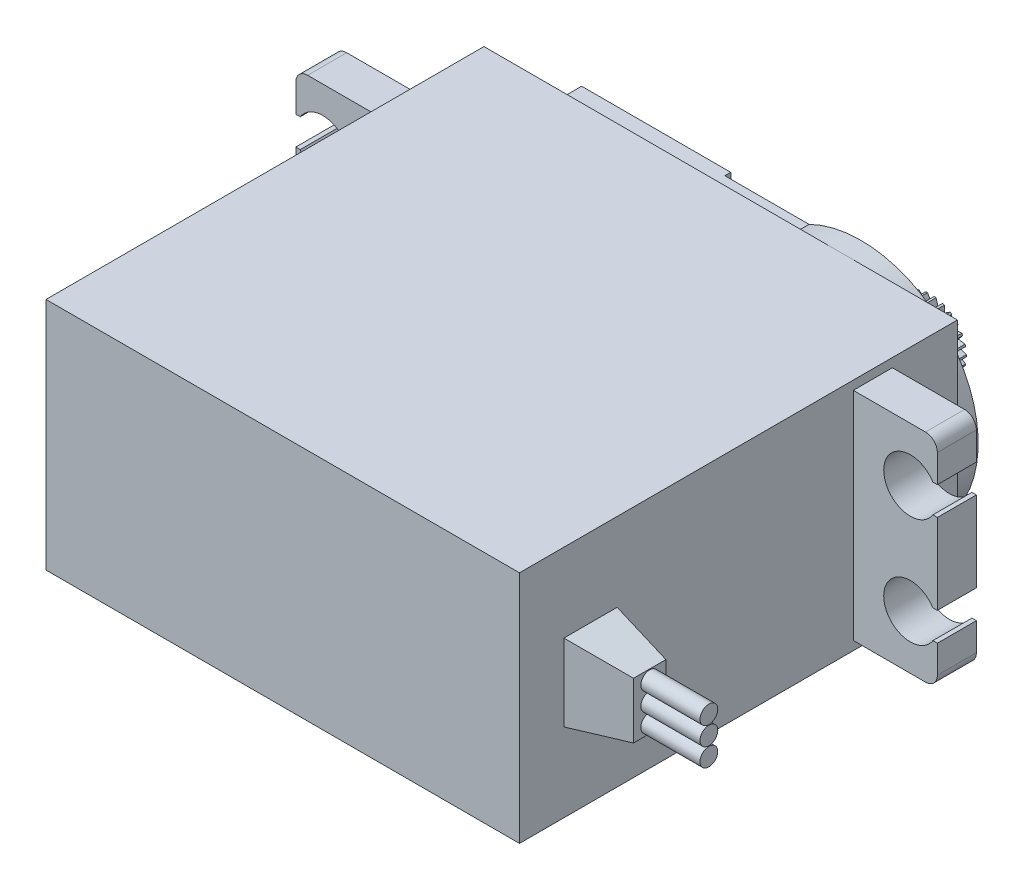
from build123d import *

# Parameters (mm, degrees)
SKETCH1_W               = 40
SKETCH1_H               = 37
BOSS_EXTRUDE1_DEPTH     = 9.9
BOSS_EXTRUDE2_DEPTH     = 1.75
SKETCH3_R               = 6.55
BOSS_EXTRUDE3_DEPTH     = 1.25
SKETCH4_R               = 5.375
BOSS_EXTRUDE4_DEPTH     = 0.65
SKETCH5_W               = 3.3
SKETCH5_H               = 18.3
BOSS_EXTRUDE5_DEPTH     = 7.1
SKETCH6_R               = 2.25
CUT_EXTRUDE1_DEPTH      = 3.3
FILLET1_R               = 1
MIRROR4_COPY_1_SKETCH_R = 2.25
MIRROR4_COPY_1_DEPTH    = 3.3
FILLET1_OF_MIRROR4_R    = 1
BOSS_EXTRUDE6_DEPTH     = 0.5
SKETCH9_W               = 4.5
SKETCH9_H               = 6.5
BOSS_EXTRUDE7_DEPTH     = 5
BOSS_EXTRUDE7_TAPER     = 10
SKETCH10_R              = 0.75
BOSS_EXTRUDE9_DEPTH     = 5
SKETCH11_R              = 3
BOSS_EXTRUDE10_DEPTH    = 4
CUT_EXTRUDE3_START      = -4
CUT_EXTRUDE3_DEPTH      = 4
SKETCH13_R              = 1.3
CUT_EXTRUDE4_DEPTH      = 4
BOSS_EXTRUDE11_DEPTH    = 0.5


with BuildPart() as part:
    # Sketch1 → Boss-Extrude1 (new, symmetric)
    with BuildSketch(Plane(origin=(0, 0, 0), x_dir=(1, 0, 0), z_dir=(0, 1, 0))):
        Rectangle(SKETCH1_W, SKETCH1_H)
    extrude(amount=BOSS_EXTRUDE1_DEPTH, both=True)

    # Sketch2 → Boss-Extrude2 (add)
    with BuildSketch(Plane(origin=(0, 0, -18.5), x_dir=(-1, 0, 0), z_dir=(0, 0, -1))):
        with BuildLine():
            Line((14, 8.875), (-5.713158881, 8.875))
            ThreePointArc((-5.713158881, 8.875), (-20, 0), (-5.713158881, -8.875))
            Line((-5.713158881, -8.875), (14, -8.875))
            Line((14, -8.875), (14, -4.625))
            ThreePointArc((14, -4.625), (16.25, 0), (14, 4.625))
            Line((14, 4.625), (14, 8.875))
        make_face()
    extrude(amount=BOSS_EXTRUDE2_DEPTH)

    # Sketch3 → Boss-Extrude3 (add)
    with BuildSketch(Plane(origin=(0, 0, -20.25), x_dir=(-1, 0, 0), z_dir=(0, 0, -1))):
        with Locations((-10.1, 0)):
            Circle(SKETCH3_R)
    extrude(amount=BOSS_EXTRUDE3_DEPTH)

    # Sketch4 → Boss-Extrude4 (add)
    with BuildSketch(Plane(origin=(0, 0, -21.5), x_dir=(-1, 0, 0), z_dir=(0, 0, -1))):
        with Locations((-10.1, 0)):
            Circle(SKETCH4_R)
    extrude(amount=BOSS_EXTRUDE4_DEPTH)

    # Sketch5 → Boss-Extrude5 (add)
    with BuildSketch(Plane.ZY.offset(20)):
        with Locations((-11.35, 0)):
            Rectangle(SKETCH5_W, SKETCH5_H)
    boss_extrude5 = extrude(amount=BOSS_EXTRUDE5_DEPTH)

    # Sketch6 → Cut-Extrude1 (cut)
    with BuildSketch(Plane(origin=(0, 0, -13), x_dir=(-1, 0, 0), z_dir=(0, 0, -1))):
        with BuildLine():
            Line((26.723286631, 3.4), (27.1, 3.4))
            Line((27.1, 3.4), (27.1, 5.8))
            Line((27.1, 5.8), (26.723286631, 5.8))
            ThreePointArc((26.723286631, 5.8), (26.981584479, 5.224541864), (27.07, 4.6))
            ThreePointArc((27.07, 4.6), (26.981584479, 3.975458136), (26.723286631, 3.4))
        make_face()
        with Locations((24.82, 4.6)):
            Circle(SKETCH6_R)
    cut_extrude1 = extrude(amount=-CUT_EXTRUDE1_DEPTH, mode=Mode.SUBTRACT)

    # Mirror1: Cut-Extrude1 across plane
    add(cut_extrude1.mirror(Plane.ZX), mode=Mode.SUBTRACT)

    # Fillet1
    fillet1_edges = [part.edges().sort_by_distance(p)[0] for p in [
        (-27.1, 9.15, -11.35),
        (-27.1, -9.15, -11.35),
    ]]
    fillet(fillet1_edges, radius=FILLET1_R)

    # Mirror4: Boss-Extrude5, Cut-Extrude1 across plane
    add(boss_extrude5.mirror(Plane(origin=(0, 0, 0), x_dir=(0, 0, 1), z_dir=(1, 0, 0))))
    add(cut_extrude1.mirror(Plane(origin=(0, 0, 0), x_dir=(0, 0, 1), z_dir=(1, 0, 0))), mode=Mode.SUBTRACT)

    # Mirror4 copy 1 sketch → Mirror4 copy 1 (cut)
    with BuildSketch(Plane(origin=(0, 0, -13), x_dir=(1, 0, 0), z_dir=(0, 0, -1))):
        with BuildLine():
            Line((26.723286631, 3.4), (27.1, 3.4))
            Line((27.1, 3.4), (27.1, 5.8))
            Line((27.1, 5.8), (26.723286631, 5.8))
            ThreePointArc((26.723286631, 5.8), (26.981584479, 5.224541864), (27.07, 4.6))
            ThreePointArc((27.07, 4.6), (26.981584479, 3.975458136), (26.723286631, 3.4))
        make_face()
        with Locations((24.82, 4.6)):
            Circle(MIRROR4_COPY_1_SKETCH_R)
    extrude(amount=-MIRROR4_COPY_1_DEPTH, mode=Mode.SUBTRACT)

    # Fillet1 of Mirror4
    fillet1_of_mirror4_edges = [part.edges().sort_by_distance(p)[0] for p in [
        (27.1, 9.15, -11.35),
        (27.1, -9.15, -11.35),
    ]]
    fillet(fillet1_of_mirror4_edges, radius=FILLET1_OF_MIRROR4_R)

    # Sketch8 → Boss-Extrude6 (add)
    with BuildSketch(Plane(origin=(0, 0, -20.25), x_dir=(-1, 0, 0), z_dir=(0, 0, -1))):
        with BuildLine():
            Line((1.4, -1.875), (1.4, 1.875))
            ThreePointArc((1.4, 1.875), (-0.475, 0), (1.4, -1.875))
        make_face()
        Polygon((14, 4.625), (14, 8.875), (1.4, 8.875), (1.4, 1.875), (1.4, -1.875), (1.4, -8.875), (14, -8.875), (14, -4.625), align=None)
    extrude(amount=BOSS_EXTRUDE6_DEPTH)

    # Sketch9 → Boss-Extrude7 (add)
    with BuildSketch(Plane(origin=(20, 0, 0), x_dir=(0, 0, -1), z_dir=(1, 0, 0))):
        with Locations((-12.5, 0)):
            Rectangle(SKETCH9_W, SKETCH9_H)
    extrude(amount=BOSS_EXTRUDE7_DEPTH, taper=BOSS_EXTRUDE7_TAPER)

    # Sketch10 → Boss-Extrude9 (add)
    with BuildSketch(Plane(origin=(25, 0, 0), x_dir=(0, 0, -1), z_dir=(1, 0, 0))):
        with Locations(Location((-12.5, 0, 0), (0, 0, 180))):
            Circle(SKETCH10_R)
        with Locations(Location((-12.5, 1.55, 0), (0, 0, 180))):
            Circle(SKETCH10_R)
        with Locations(Location((-12.5, -1.55, 0), (0, 0, 180))):
            Circle(SKETCH10_R)
    extrude(amount=BOSS_EXTRUDE9_DEPTH)

    # Sketch11 → Boss-Extrude10 (add)
    with BuildSketch(Plane(origin=(0, 0, -22.15), x_dir=(-1, 0, 0), z_dir=(0, 0, -1))):
        with Locations((-10.1, 0)):
            Circle(SKETCH11_R)
    extrude(amount=BOSS_EXTRUDE10_DEPTH)

    # Sketch12 → Cut-Extrude3 (cut)
    with BuildSketch(Plane(origin=(0, 0, -26.15), x_dir=(-1, 0, 0), z_dir=(0, 0, -1)).offset(CUT_EXTRUDE3_START)):
        with BuildLine():
            ThreePointArc((-9.81894274, 2.986805453), (-9.959316597, 2.996699548), (-10.1, 3))
            Line((-10.1, 3), (-10.1, 2.5))
            Line((-10.1, 2.5), (-9.81894274, 2.986805453))
        make_face()
        with BuildLine():
            Line((-10.1, 2.5), (-10.1, 3))
            ThreePointArc((-10.1, 3), (-10.240683403, 2.996699548), (-10.38105726, 2.986805453))
            Line((-10.38105726, 2.986805453), (-10.1, 2.5))
        make_face()
        with BuildLine():
            Line((-10.698289161, 2.427354544), (-10.541899085, 2.96727572))
            ThreePointArc((-10.541899085, 2.96727572), (-10.680561744, 2.943288647), (-10.817946993, 2.912825452))
            Line((-10.817946993, 2.912825452), (-10.698289161, 2.427354544))
        make_face()
        with BuildLine():
            Line((-11.087679578, 2.83275291), (-10.698289161, 2.427354544))
            Line((-10.698289161, 2.427354544), (-10.817946993, 2.912825452))
            ThreePointArc((-10.817946993, 2.912825452), (-10.953752542, 2.875953163), (-11.087679578, 2.83275291))
        make_face()
        with BuildLine():
            Line((-11.26180793, 2.213640064), (-11.239173861, 2.775298707))
            ThreePointArc((-11.239173861, 2.775298707), (-11.368066753, 2.718824509), (-11.494169516, 2.656368077))
            Line((-11.494169516, 2.656368077), (-11.26180793, 2.213640064))
        make_face()
        with BuildLine():
            Line((-11.736901549, 2.514071065), (-11.26180793, 2.213640064))
            Line((-11.26180793, 2.213640064), (-11.494169516, 2.656368077))
            ThreePointArc((-11.494169516, 2.656368077), (-11.617204686, 2.588066835), (-11.736901549, 2.514071065))
        make_face()
        with BuildLine():
            Line((-7.294951272, 1.063814661), (-7.762459393, 0.886512218))
            Line((-7.762459393, 0.886512218), (-7.207624109, 0.796342708))
            ThreePointArc((-7.207624109, 0.796342708), (-7.248150226, 0.931103038), (-7.294951272, 1.063814661))
        make_face()
        with BuildLine():
            ThreePointArc((-7.294951272, 1.063814661), (-7.34792427, 1.194185571), (-7.406952665, 1.321928913))
            Line((-7.406952665, 1.321928913), (-7.762459393, 0.886512218))
            Line((-7.762459393, 0.886512218), (-7.294951272, 1.063814661))
        make_face()
        with BuildLine():
            Line((-11.757806646, 1.87127687), (-11.870243992, 2.422031422))
            ThreePointArc((-11.870243992, 2.422031422), (-12.089367975, 2.245532245), (-12.290992752, 2.049280548))
            Line((-12.290992752, 2.049280548), (-11.757806646, 1.87127687))
        make_face()
        with BuildLine():
            Line((-12.157459665, 1.420161867), (-12.398433978, 1.928004473))
            ThreePointArc((-12.398433978, 1.928004473), (-12.568951598, 1.70419424), (-12.71775142, 1.465393293))
            Line((-12.71775142, 1.465393293), (-12.157459665, 1.420161867))
        make_face()
        with BuildLine():
            Line((-12.437540607, 0.886512218), (-12.793047335, 1.321928913))
            ThreePointArc((-12.793047335, 1.321928913), (-12.905048728, 1.063814661), (-12.992375891, 0.796342708))
            Line((-12.992375891, 0.796342708), (-12.437540607, 0.886512218))
        make_face()
        with BuildLine():
            Line((-9.501710839, 2.427354544), (-9.112320422, 2.83275291))
            ThreePointArc((-9.112320422, 2.83275291), (-9.382053007, 2.912825452), (-9.658100915, 2.96727572))
            Line((-9.658100915, 2.96727572), (-9.501710839, 2.427354544))
        make_face()
        with BuildLine():
            Line((-8.93819207, 2.213640064), (-8.463098451, 2.514071065))
            ThreePointArc((-8.463098451, 2.514071065), (-8.705830484, 2.656368077), (-8.960826139, 2.775298707))
            Line((-8.960826139, 2.775298707), (-8.93819207, 2.213640064))
        make_face()
        with BuildLine():
            Line((-8.442193354, 1.87127687), (-7.909007248, 2.049280548))
            ThreePointArc((-7.909007248, 2.049280548), (-8.110632025, 2.245532245), (-8.329756008, 2.422031422))
            Line((-8.329756008, 2.422031422), (-8.442193354, 1.87127687))
        make_face()
        with BuildLine():
            Line((-8.042540335, 1.420161867), (-7.48224858, 1.465393293))
            ThreePointArc((-7.48224858, 1.465393293), (-7.631048402, 1.70419424), (-7.801566022, 1.928004473))
            Line((-7.801566022, 1.928004473), (-8.042540335, 1.420161867))
        make_face()
        with BuildLine():
            Line((-7.618227815, 0.301341701), (-7.101094012, 0.081011578))
            ThreePointArc((-7.101094012, 0.081011578), (-7.121873378, 0.361610041), (-7.16884943, 0.63902765))
            Line((-7.16884943, 0.63902765), (-7.618227815, 0.301341701))
        make_face()
        with BuildLine():
            Line((-7.618227815, -0.301341701), (-7.16884943, -0.63902765))
            ThreePointArc((-7.16884943, -0.63902765), (-7.121873378, -0.361610041), (-7.101094012, -0.081011578))
            Line((-7.101094012, -0.081011578), (-7.618227815, -0.301341701))
        make_face()
        with BuildLine():
            Line((-7.762459393, -0.886512218), (-7.406952665, -1.321928913))
            ThreePointArc((-7.406952665, -1.321928913), (-7.294951272, -1.063814661), (-7.207624109, -0.796342708))
            Line((-7.207624109, -0.796342708), (-7.762459393, -0.886512218))
        make_face()
        with BuildLine():
            Line((-8.042540335, -1.420161867), (-7.801566022, -1.928004473))
            ThreePointArc((-7.801566022, -1.928004473), (-7.631048402, -1.70419424), (-7.48224858, -1.465393293))
            Line((-7.48224858, -1.465393293), (-8.042540335, -1.420161867))
        make_face()
        with BuildLine():
            Line((-8.442193354, -1.87127687), (-7.909007248, -2.049280548))
            ThreePointArc((-7.909007248, -2.049280548), (-8.110632025, -2.245532245), (-8.329756008, -2.422031422))
            Line((-8.329756008, -2.422031422), (-8.442193354, -1.87127687))
        make_face()
        with BuildLine():
            Line((-8.93819207, -2.213640064), (-8.960826139, -2.775298707))
            ThreePointArc((-8.960826139, -2.775298707), (-8.705830484, -2.656368077), (-8.463098451, -2.514071065))
            Line((-8.463098451, -2.514071065), (-8.93819207, -2.213640064))
        make_face()
        with BuildLine():
            Line((-9.501710839, -2.427354544), (-9.112320422, -2.83275291))
            ThreePointArc((-9.112320422, -2.83275291), (-9.382053007, -2.912825452), (-9.658100915, -2.96727572))
            Line((-9.658100915, -2.96727572), (-9.501710839, -2.427354544))
        make_face()
        with BuildLine():
            Line((-10.1, -2.5), (-9.81894274, -2.986805453))
            ThreePointArc((-9.81894274, -2.986805453), (-10.1, -3), (-10.38105726, -2.986805453))
            Line((-10.38105726, -2.986805453), (-10.1, -2.5))
        make_face()
        with BuildLine():
            Line((-10.698289161, -2.427354544), (-10.541899085, -2.96727572))
            ThreePointArc((-10.541899085, -2.96727572), (-10.817946993, -2.912825452), (-11.087679578, -2.83275291))
            Line((-11.087679578, -2.83275291), (-10.698289161, -2.427354544))
        make_face()
        with BuildLine():
            Line((-11.26180793, -2.213640064), (-11.239173861, -2.775298707))
            ThreePointArc((-11.239173861, -2.775298707), (-11.494169516, -2.656368077), (-11.736901549, -2.514071065))
            Line((-11.736901549, -2.514071065), (-11.26180793, -2.213640064))
        make_face()
        with BuildLine():
            Line((-11.757806646, -1.87127687), (-11.870243992, -2.422031422))
            ThreePointArc((-11.870243992, -2.422031422), (-12.089367975, -2.245532245), (-12.290992752, -2.049280548))
            Line((-12.290992752, -2.049280548), (-11.757806646, -1.87127687))
        make_face()
        with BuildLine():
            Line((-12.157459665, -1.420161867), (-12.398433978, -1.928004473))
            ThreePointArc((-12.398433978, -1.928004473), (-12.568951598, -1.70419424), (-12.71775142, -1.465393293))
            Line((-12.71775142, -1.465393293), (-12.157459665, -1.420161867))
        make_face()
        with BuildLine():
            Line((-12.437540607, -0.886512218), (-12.793047335, -1.321928913))
            ThreePointArc((-12.793047335, -1.321928913), (-12.905048728, -1.063814661), (-12.992375891, -0.796342708))
            Line((-12.992375891, -0.796342708), (-12.437540607, -0.886512218))
        make_face()
        with BuildLine():
            Line((-12.581772185, -0.301341701), (-13.03115057, -0.63902765))
            ThreePointArc((-13.03115057, -0.63902765), (-13.078126622, -0.361610041), (-13.098905988, -0.081011578))
            Line((-13.098905988, -0.081011578), (-12.581772185, -0.301341701))
        make_face()
        with BuildLine():
            Line((-12.581772185, 0.301341701), (-13.098905988, 0.081011578))
            ThreePointArc((-13.098905988, 0.081011578), (-13.078126622, 0.361610041), (-13.03115057, 0.63902765))
            Line((-13.03115057, 0.63902765), (-12.581772185, 0.301341701))
        make_face()
    extrude(amount=CUT_EXTRUDE3_DEPTH, mode=Mode.SUBTRACT)

    # Sketch13 → Cut-Extrude4 (cut)
    with BuildSketch(Plane(origin=(0, 0, -26.15), x_dir=(-1, 0, 0), z_dir=(0, 0, -1))):
        with Locations((-10.1, 0)):
            Circle(SKETCH13_R)
    extrude(amount=-CUT_EXTRUDE4_DEPTH, mode=Mode.SUBTRACT)

    # Sketch14 → Boss-Extrude11 (add, symmetric)
    with BuildSketch(Plane(origin=(0, 0, 0), x_dir=(1, 0, 0), z_dir=(0, 1, 0))):
        Polygon((20, 14.25), (27.1, 13), (20, 13), align=None)
    boss_extrude11 = extrude(amount=BOSS_EXTRUDE11_DEPTH, both=True)

    # Mirror5: Boss-Extrude11 across plane
    add(boss_extrude11.mirror(Plane(origin=(0, 0, 0), x_dir=(0, 0, 1), z_dir=(1, 0, 0))))


solid = part.part
